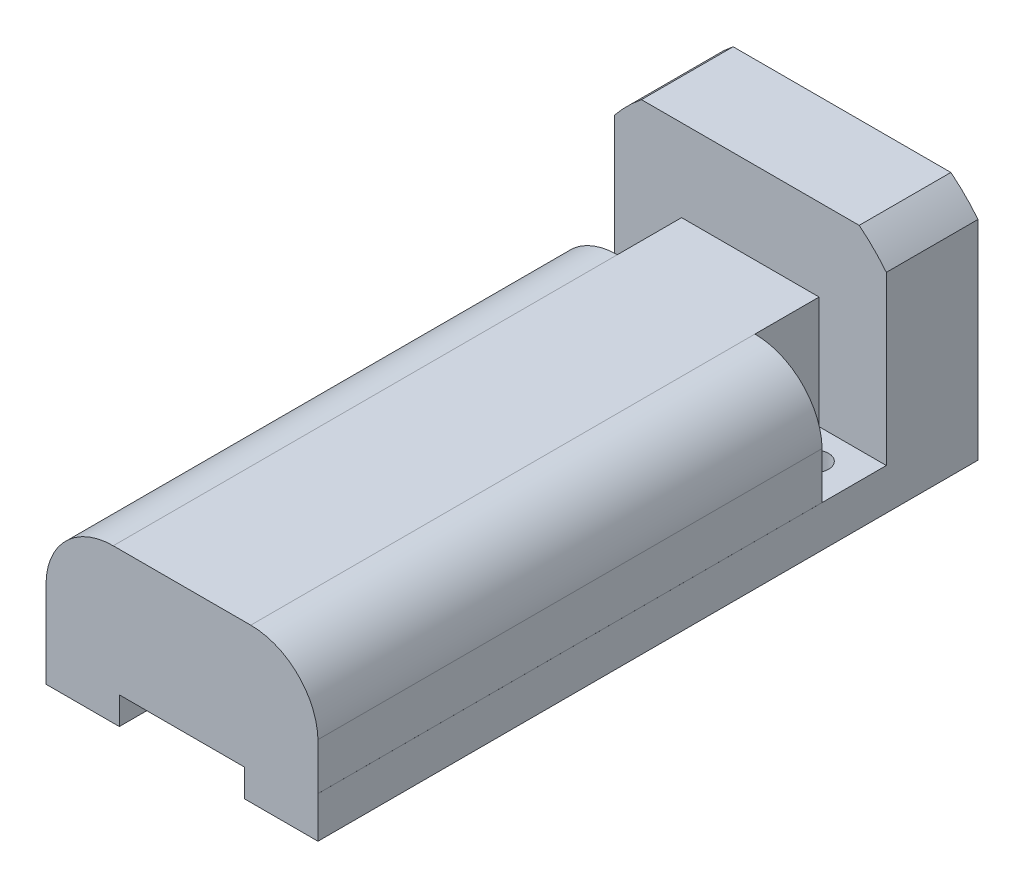
from build123d import *

# Parameters (mm, degrees)
BOSS_EXTRUDE1_DEPTH = 72
BOSS_EXTRUDE3_DEPTH = 5
CUT_EXTRUDE4_DEPTH  = 5
BOSS_EXTRUDE4_DEPTH = 5
BOSS_EXTRUDE5_START = 7
BOSS_EXTRUDE5_DEPTH = 55
CUT_EXTRUDE8_DEPTH  = 5
SKETCH19_W          = 15
SKETCH19_H          = 12.25
BOSS_EXTRUDE8_DEPTH = 7
CUT_EXTRUDE9_REACH  = 78.51
SKETCH20_R          = 1.5
SKETCH21_W          = 23.7
SKETCH21_H          = 22.72285099
CUT_EXTRUDE10_DEPTH = 7


with BuildPart() as part:
    # Sketch1 → Boss-Extrude1 (new body)
    with BuildSketch(Plane.XY):
        Polygon((-14.835, 0), (-6.835, 0), (-6.835, 3), (6.835, 3), (6.835, 0), (14.835, 0), (14.835, 4.5), (8.35, 4.5), (-8.35, 4.5), (-14.835, 4.5), align=None)
    extrude(amount=-BOSS_EXTRUDE1_DEPTH)

    # Sketch8 → Boss-Extrude3 (add)
    with BuildSketch(Plane(origin=(0, 0, -72), x_dir=(-1, 0, 0), z_dir=(0, 0, -1))):
        Polygon((-14.835, 25.70785099), (-14.835, 0), (-10.35, 0), (-10.35, 21.22285099), (10.35, 21.22285099), (10.35, 0), (14.835, 0), (14.835, 25.70785099), align=None)
    extrude(amount=-BOSS_EXTRUDE3_DEPTH)

    # Sketch9 → Cut-Extrude4 (cut)
    with BuildSketch(Plane(origin=(0, 0, -72), x_dir=(-1, 0, 0), z_dir=(0, 0, -1))):
        with BuildLine():
            Line((-15.009070225, 25.881921215), (-15.009070225, 22.527488279))
            ThreePointArc((-15.009070225, 22.527488279), (-13.436955933, 24.309806923), (-11.654637289, 25.881921215))
            Line((-11.654637289, 25.881921215), (-15.009070225, 25.881921215))
        make_face()
        with BuildLine():
            Line((15.009070225, 25.881921215), (15.009070225, 22.527488279))
            ThreePointArc((15.009070225, 22.527488279), (13.436955933, 24.309806923), (11.654637289, 25.881921215))
            Line((11.654637289, 25.881921215), (15.009070225, 25.881921215))
        make_face()
    extrude(amount=-CUT_EXTRUDE4_DEPTH, mode=Mode.SUBTRACT)

    # Sketch11 → Boss-Extrude4 (add)
    with BuildSketch(Plane.XY.offset(-67)):
        with BuildLine():
            Line((14.835, 4.5), (14.835, 22.748275799))
            ThreePointArc((14.835, 22.748275799), (13.436955933, 24.309806923), (11.875424809, 25.70785099))
            Line((11.875424809, 25.70785099), (-11.875424809, 25.70785099))
            ThreePointArc((-11.875424809, 25.70785099), (-13.436955933, 24.309806923), (-14.835, 22.748275799))
            Line((-14.835, 22.748275799), (-14.835, 4.5))
            Line((-14.835, 4.5), (14.835, 4.5))
        make_face()
    extrude(amount=BOSS_EXTRUDE4_DEPTH)

    # Sketch12 → Boss-Extrude5 (add)
    with BuildSketch(Plane.XY.offset(-62).offset(BOSS_EXTRUDE5_START)):
        with BuildLine():
            Line((-14.835, 4.5), (14.832662348, 4.5))
            Line((14.832662348, 4.5), (14.832662348, 9.600169894))
            ThreePointArc((14.832662348, 9.600169894), (12.620742321, 14.666687642), (7.5, 16.75))
            Line((7.5, 16.75), (-7.5, 16.75))
            ThreePointArc((-7.5, 16.75), (-12.68662824, 14.60162824), (-14.835, 9.415))
            Line((-14.835, 9.415), (-14.835, 4.5))
        make_face()
    extrude(amount=BOSS_EXTRUDE5_DEPTH)

    # Sketch18 → Cut-Extrude8 (cut)
    with BuildSketch(Plane(origin=(0, 0, -72), x_dir=(-1, 0, 0), z_dir=(0, 0, -1))):
        Polygon((-10.35, 4.5), (-10.35, 0), (-6.835, 0), (-6.835, 3), (6.835, 3), (6.835, 0), (10.35, 0), (10.35, 4.5), align=None)
    extrude(amount=-CUT_EXTRUDE8_DEPTH, mode=Mode.SUBTRACT)

    # Sketch19 → Boss-Extrude8 (add)
    with BuildSketch(Plane(origin=(0, 0, -55), x_dir=(-1, 0, 0), z_dir=(0, 0, -1))):
        with Locations((0, 10.625)):
            Rectangle(SKETCH19_W, SKETCH19_H)
    extrude(amount=BOSS_EXTRUDE8_DEPTH)

    # Sketch20 → Cut-Extrude9 (cut, up to next)
    with BuildSketch(Plane(origin=(0, 4.5, 0), x_dir=(1, 0, 0), z_dir=(0, 1, 0)), mode=Mode.PRIVATE) as cut_extrude9_sk1:
        with Locations(Location((-10.5425, 58.5, 0), (0, 0, 180))):
            Circle(SKETCH20_R)
    cut_extrude9_tool1 = extrude(cut_extrude9_sk1.sketch, amount=-CUT_EXTRUDE9_REACH, mode=Mode.PRIVATE) & part.part
    # Sketch20 → Cut-Extrude9 (cut, up to next)
    with BuildSketch(Plane(origin=(0, 4.5, 0), x_dir=(1, 0, 0), z_dir=(0, 1, 0)), mode=Mode.PRIVATE) as cut_extrude9_sk2:
        with Locations(Location((10.5425, 58.5, 0), (0, 0, 270))):
            Circle(SKETCH20_R)
    cut_extrude9_tool2 = extrude(cut_extrude9_sk2.sketch, amount=-CUT_EXTRUDE9_REACH, mode=Mode.PRIVATE) & part.part
    add(cut_extrude9_tool1.solids().sort_by_distance((-10.5425, 4.5, -58.5))[0], mode=Mode.SUBTRACT)
    add(cut_extrude9_tool2.solids().sort_by_distance((10.5425, 4.5, -58.5))[0], mode=Mode.SUBTRACT)

    # Sketch21 → Cut-Extrude10 (cut)
    with BuildSketch(Plane(origin=(0, 0, -72), x_dir=(-1, 0, 0), z_dir=(0, 0, -1))):
        with Locations((0, 11.361425495)):
            Rectangle(SKETCH21_W, SKETCH21_H)
    extrude(amount=-CUT_EXTRUDE10_DEPTH, mode=Mode.SUBTRACT)


solid = part.part
